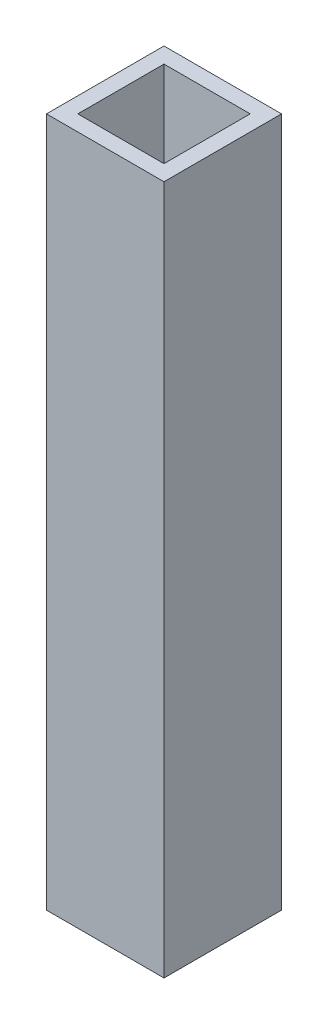
from build123d import *

# Parameters (mm, degrees)
SKETCH1_W           = 15
SKETCH1_H           = 15
SKETCH1_W_2         = 11
SKETCH1_H_2         = 11
BOSS_EXTRUDE1_DEPTH = 88


with BuildPart() as part:
    # Sketch1 → Boss-Extrude1 (new body)
    with BuildSketch(Plane(origin=(0, 0, 0), x_dir=(1, 0, 0), z_dir=(0, 1, 0))):
        with Locations((7.5, 7.5)):
            Rectangle(SKETCH1_W, SKETCH1_H)
        with Locations((7.5, 7.5)):
            Rectangle(SKETCH1_W_2, SKETCH1_H_2, mode=Mode.SUBTRACT)
    extrude(amount=BOSS_EXTRUDE1_DEPTH)


solid = part.part
